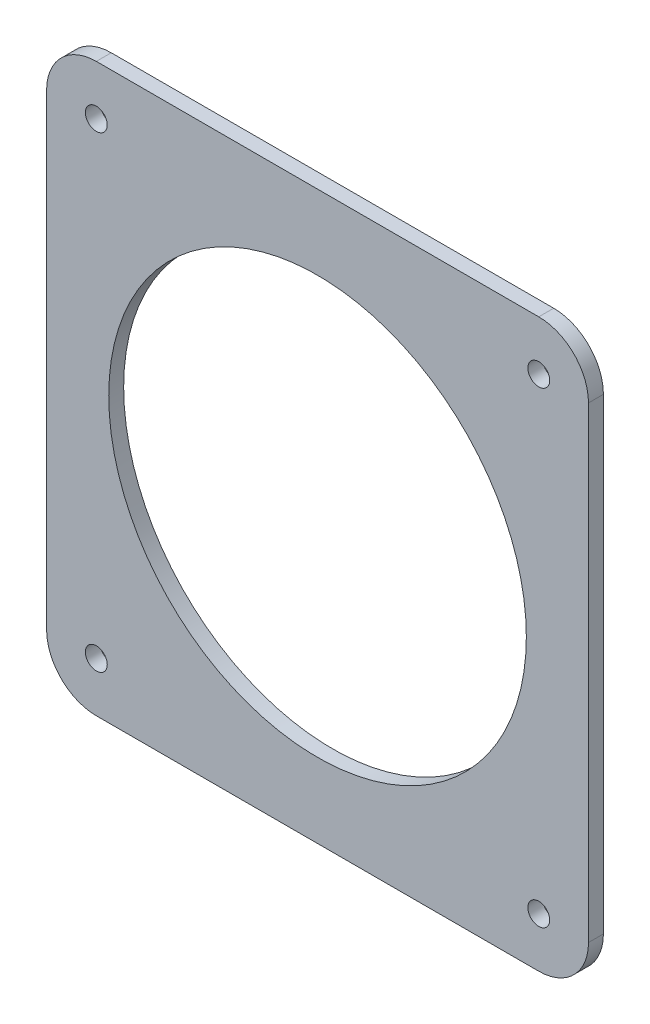
from build123d import *

# Parameters (mm, degrees)
SKETCH_1_W      = 109
SKETCH_1_H      = 114
SKETCH_1_R      = 2.2
SKETCH_1_R_2    = 42
EXTRUDE_1_DEPTH = 3
FILLET_3_R      = 10


with BuildPart() as part:
    # 草图1 → 凸台-拉伸1 (new body)
    with BuildSketch(Plane.XY):
        with Locations((54.5, -57)):
            Rectangle(SKETCH_1_W, SKETCH_1_H)
        with Locations((99, -10)):
            Circle(SKETCH_1_R, mode=Mode.SUBTRACT)
        with Locations((99, -104)):
            Circle(SKETCH_1_R, mode=Mode.SUBTRACT)
        with Locations((10, -10)):
            Circle(SKETCH_1_R, mode=Mode.SUBTRACT)
        with Locations((10, -104)):
            Circle(SKETCH_1_R, mode=Mode.SUBTRACT)
        with Locations((54.5, -57)):
            Circle(SKETCH_1_R_2, mode=Mode.SUBTRACT)
    extrude(amount=EXTRUDE_1_DEPTH)

    # 圆角3
    fillet_3_edges = [part.edges().sort_by_distance(p)[0] for p in [
        (0, 0, 1.5),
        (109, 0, 1.5),
        (109, -114, 1.5),
        (0, -114, 1.5),
    ]]
    fillet(fillet_3_edges, radius=FILLET_3_R)


solid = part.part
